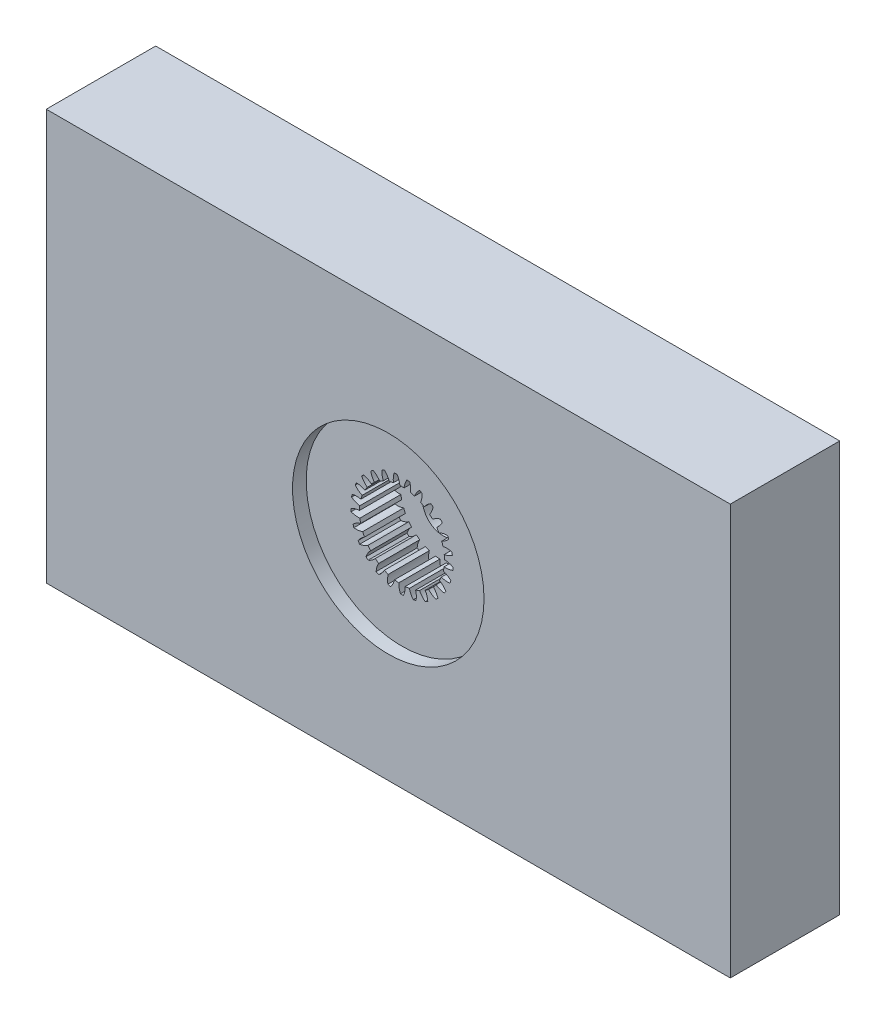
from build123d import *

# Parameters (mm, degrees)
SKETCH_1_W          = 50
SKETCH_1_H          = 30
EXTRUDE_1_DEPTH     = 8
SKETCH_2_R          = 3.731926356
SKETCH_2_R_2        = 1.5
EXTRUDE_2_DEPTH     = 4
SKETCH_3_R          = 3
CUT_EXTRUDE_1_DEPTH = 1
DRAFT_1_ANGLE       = 1
SKETCH_4_R          = 7
CUT_EXTRUDE_2_DEPTH = 1


with BuildPart() as part:
    # 草图1 → 凸台-拉伸1 (new body)
    with BuildSketch(Plane.XY):
        with Locations((-21.229575384, 10.124967507)):
            Rectangle(SKETCH_1_W, SKETCH_1_H)
        with BuildLine():
            ThreePointArc((-19.953798149, 13.632055583), (-20.162265024, 13.383796013), (-20.307173546, 13.093808474))
            ThreePointArc((-20.307173546, 13.093808474), (-20.456440087, 13.136130679), (-20.607632232, 13.170953153))
            ThreePointArc((-20.607632232, 13.170953153), (-20.594913976, 13.494881383), (-20.657994932, 13.812862586))
            ThreePointArc((-20.657994932, 13.812862586), (-20.761840986, 13.827466509), (-20.866056374, 13.839146858))
            ThreePointArc((-20.866056374, 13.839146858), (-21.006234235, 13.546843215), (-21.074473221, 13.229928884))
            ThreePointArc((-21.074473221, 13.229928884), (-21.229575384, 13.233800381), (-21.384677547, 13.229928884))
            ThreePointArc((-21.384677547, 13.229928884), (-21.452916533, 13.546843215), (-21.593094394, 13.839146858))
            ThreePointArc((-21.593094394, 13.839146858), (-21.697309781, 13.827466509), (-21.801155836, 13.812862586))
            ThreePointArc((-21.801155836, 13.812862586), (-21.864236792, 13.494881383), (-21.851518535, 13.170953153))
            ThreePointArc((-21.851518535, 13.170953153), (-22.00271068, 13.136130679), (-22.151977222, 13.093808474))
            ThreePointArc((-22.151977222, 13.093808474), (-22.296885744, 13.383796013), (-22.505352619, 13.632055583))
            ThreePointArc((-22.505352619, 13.632055583), (-22.603389104, 13.594824879), (-22.700340796, 13.554854302))
            ThreePointArc((-22.700340796, 13.554854302), (-22.682361238, 13.231175467), (-22.589484874, 12.92058694))
            ThreePointArc((-22.589484874, 12.92058694), (-22.727267043, 12.849258521), (-22.861318997, 12.771144867))
            ThreePointArc((-22.861318997, 12.771144867), (-23.073791919, 13.01598463), (-23.337449069, 13.204601065))
            ThreePointArc((-23.337449069, 13.204601065), (-23.423146658, 13.14415935), (-23.507112156, 13.081333617))
            ThreePointArc((-23.507112156, 13.081333617), (-23.409201806, 12.772295082), (-23.242003098, 12.494561677))
            ThreePointArc((-23.242003098, 12.494561677), (-23.35771793, 12.39120914), (-23.46813232, 12.282212204))
            ThreePointArc((-23.46813232, 12.282212204), (-23.734819188, 12.466520008), (-24.037100063, 12.583641845))
            ThreePointArc((-24.037100063, 12.583641845), (-24.105074062, 12.503786894), (-24.170777505, 12.422053576))
            ThreePointArc((-24.170777505, 12.422053576), (-23.99908843, 12.147073369), (-23.768073088, 11.919646098))
            ThreePointArc((-23.768073088, 11.919646098), (-23.854449795, 11.790763462), (-23.934288877, 11.657731923))
            ThreePointArc((-23.934288877, 11.657731923), (-24.238432774, 11.769927032), (-24.560343956, 11.808195073))
            ThreePointArc((-24.560343956, 11.808195073), (-24.606323308, 11.713944467), (-24.649636307, 11.61843917))
            ThreePointArc((-24.649636307, 11.61843917), (-24.414956364, 11.394795308), (-24.134639931, 11.231964262))
            ThreePointArc((-24.134639931, 11.231964262), (-24.186251147, 11.085649698), (-24.230498339, 10.936942417))
            ThreePointArc((-24.230498339, 10.936942417), (-24.552988785, 10.969975199), (-24.87430341, 10.926984924))
            ThreePointArc((-24.87430341, 10.926984924), (-24.895399064, 10.824260773), (-24.913600103, 10.720984446))
            ThreePointArc((-24.913600103, 10.720984446), (-24.630675096, 10.562729296), (-24.318670884, 10.474725749))
            ThreePointArc((-24.318670884, 10.474725749), (-24.332273686, 10.320172738), (-24.338148775, 10.165133541))
            ThreePointArc((-24.338148775, 10.165133541), (-24.658722509, 10.116928424), (-24.959251198, 9.99538107))
            ThreePointArc((-24.959251198, 9.99538107), (-24.954137635, 9.890637912), (-24.946083078, 9.786079786))
            ThreePointArc((-24.946083078, 9.786079786), (-24.632690224, 9.703157101), (-24.308602606, 9.695510639))
            ThreePointArc((-24.308602606, 9.695510639), (-24.28334228, 9.542430316), (-24.250476112, 9.390800885))
            ThreePointArc((-24.250476112, 9.390800885), (-24.548990308, 9.264386775), (-24.809849738, 9.071919609))
            ThreePointArc((-24.809849738, 9.071919609), (-24.778848263, 8.971738841), (-24.745044205, 8.872468688))
            ThreePointArc((-24.745044205, 8.872468688), (-24.420875131, 8.870088805), (-24.105067724, 8.943279884))
            ThreePointArc((-24.105067724, 8.943279884), (-24.04253147, 8.801290848), (-23.972989146, 8.662598618))
            ThreePointArc((-23.972989146, 8.662598618), (-24.230687059, 8.465918579), (-24.435486472, 8.21462502))
            ThreePointArc((-24.435486472, 8.21462502), (-24.380545022, 8.125301369), (-24.323115498, 8.037556697))
            ThreePointArc((-24.323115498, 8.037556697), (-24.008538939, 8.115869153), (-23.720855083, 8.265298908))
            ThreePointArc((-23.720855083, 8.265298908), (-23.624972283, 8.143322853), (-23.523123404, 8.026282367))
            ThreePointArc((-23.523123404, 8.026282367), (-23.723812926, 7.771694528), (-23.859684023, 7.477364275))
            ThreePointArc((-23.859684023, 7.477364275), (-23.78425477, 7.404510274), (-23.706808288, 7.333804404))
            ThreePointArc((-23.706808288, 7.333804404), (-23.421590245, 7.487888539), (-23.180106176, 7.704167749))
            ThreePointArc((-23.180106176, 7.704167749), (-23.056901499, 7.609868879), (-22.929145605, 7.521834222))
            ThreePointArc((-22.929145605, 7.521834222), (-23.060216676, 7.225335273), (-23.118622174, 6.906462179))
            ThreePointArc((-23.118622174, 6.906462179), (-23.027444617, 6.854655512), (-22.934847424, 6.805431154))
            ThreePointArc((-22.934847424, 6.805431154), (-22.696909197, 7.025605296), (-22.516798246, 7.295144343))
            ThreePointArc((-22.516798246, 7.295144343), (-22.374013095, 7.234447802), (-22.228377558, 7.180950514))
            ThreePointArc((-22.228377558, 7.180950514), (-22.2815945, 6.861170575), (-22.258864569, 6.537790609))
            ThreePointArc((-22.258864569, 6.537790609), (-22.157667728, 6.51028648), (-22.055738046, 6.485636582))
            ThreePointArc((-22.055738046, 6.485636582), (-21.880030168, 6.758066379), (-21.772609369, 7.063929133))
            ThreePointArc((-21.772609369, 7.063929133), (-21.619215461, 7.040648709), (-21.464851098, 7.025050221))
            ThreePointArc((-21.464851098, 7.025050221), (-21.436870094, 6.702082242), (-21.334432938, 6.394514556))
            ThreePointArc((-21.334432938, 6.394514556), (-21.229575384, 6.393041151), (-21.124717829, 6.394514556))
            ThreePointArc((-21.124717829, 6.394514556), (-21.022280673, 6.702082242), (-20.99429967, 7.025050221))
            ThreePointArc((-20.99429967, 7.025050221), (-20.839935307, 7.040648709), (-20.686541398, 7.063929133))
            ThreePointArc((-20.686541398, 7.063929133), (-20.579120599, 6.758066379), (-20.403412722, 6.485636582))
            ThreePointArc((-20.403412722, 6.485636582), (-20.30148304, 6.51028648), (-20.200286199, 6.537790609))
            ThreePointArc((-20.200286199, 6.537790609), (-20.177556268, 6.861170575), (-20.230773209, 7.180950514))
            ThreePointArc((-20.230773209, 7.180950514), (-20.085137673, 7.234447802), (-19.942352522, 7.295144343))
            ThreePointArc((-19.942352522, 7.295144343), (-19.762241571, 7.025605296), (-19.524303344, 6.805431154))
            ThreePointArc((-19.524303344, 6.805431154), (-19.43170615, 6.854655512), (-19.340528593, 6.906462179))
            ThreePointArc((-19.340528593, 6.906462179), (-19.398934092, 7.225335273), (-19.530005163, 7.521834222))
            ThreePointArc((-19.530005163, 7.521834222), (-19.402249269, 7.609868879), (-19.279044592, 7.704167749))
            ThreePointArc((-19.279044592, 7.704167749), (-19.037560522, 7.487888539), (-18.75234248, 7.333804404))
            ThreePointArc((-18.75234248, 7.333804404), (-18.674895997, 7.404510274), (-18.599466745, 7.477364275))
            ThreePointArc((-18.599466745, 7.477364275), (-18.735337841, 7.771694528), (-18.936027363, 8.026282367))
            ThreePointArc((-18.936027363, 8.026282367), (-18.834178485, 8.143322853), (-18.738295685, 8.265298908))
            ThreePointArc((-18.738295685, 8.265298908), (-18.450611829, 8.115869153), (-18.13603527, 8.037556697))
            ThreePointArc((-18.13603527, 8.037556697), (-18.078605746, 8.125301369), (-18.023664295, 8.21462502))
            ThreePointArc((-18.023664295, 8.21462502), (-18.228463709, 8.465918579), (-18.486161621, 8.662598618))
            ThreePointArc((-18.486161621, 8.662598618), (-18.416619298, 8.801290848), (-18.354083044, 8.943279884))
            ThreePointArc((-18.354083044, 8.943279884), (-18.038275637, 8.870088805), (-17.714106563, 8.872468688))
            ThreePointArc((-17.714106563, 8.872468688), (-17.680302505, 8.971738841), (-17.64930103, 9.071919609))
            ThreePointArc((-17.64930103, 9.071919609), (-17.91016046, 9.264386775), (-18.208674656, 9.390800885))
            ThreePointArc((-18.208674656, 9.390800885), (-18.175808487, 9.542430316), (-18.150548161, 9.695510639))
            ThreePointArc((-18.150548161, 9.695510639), (-17.826460544, 9.703157101), (-17.51306769, 9.786079786))
            ThreePointArc((-17.51306769, 9.786079786), (-17.505013132, 9.890637912), (-17.499899569, 9.99538107))
            ThreePointArc((-17.499899569, 9.99538107), (-17.800428259, 10.116928424), (-18.121001993, 10.165133541))
            ThreePointArc((-18.121001993, 10.165133541), (-18.126877082, 10.320172738), (-18.140479884, 10.474725749))
            ThreePointArc((-18.140479884, 10.474725749), (-17.828475672, 10.562729296), (-17.545550664, 10.720984446))
            ThreePointArc((-17.545550664, 10.720984446), (-17.563751704, 10.824260773), (-17.584847357, 10.926984924))
            ThreePointArc((-17.584847357, 10.926984924), (-17.906161983, 10.969975199), (-18.228652429, 10.936942417))
            ThreePointArc((-18.228652429, 10.936942417), (-18.272899621, 11.085649698), (-18.324510837, 11.231964262))
            ThreePointArc((-18.324510837, 11.231964262), (-18.044194404, 11.394795308), (-17.809514461, 11.61843917))
            ThreePointArc((-17.809514461, 11.61843917), (-17.852827459, 11.713944467), (-17.898806811, 11.808195073))
            ThreePointArc((-17.898806811, 11.808195073), (-18.220717994, 11.769927032), (-18.52486189, 11.657731923))
            ThreePointArc((-18.52486189, 11.657731923), (-18.604700973, 11.790763462), (-18.69107768, 11.919646098))
            ThreePointArc((-18.69107768, 11.919646098), (-18.460062337, 12.147073369), (-18.288373263, 12.422053576))
            ThreePointArc((-18.288373263, 12.422053576), (-18.354076706, 12.503786894), (-18.422050704, 12.583641845))
            ThreePointArc((-18.422050704, 12.583641845), (-18.72433158, 12.466520008), (-18.991018448, 12.282212204))
            ThreePointArc((-18.991018448, 12.282212204), (-19.101432837, 12.39120914), (-19.217147669, 12.494561677))
            ThreePointArc((-19.217147669, 12.494561677), (-19.049948961, 12.772295082), (-18.952038611, 13.081333617))
            ThreePointArc((-18.952038611, 13.081333617), (-19.036004109, 13.14415935), (-19.121701699, 13.204601065))
            ThreePointArc((-19.121701699, 13.204601065), (-19.385358848, 13.01598463), (-19.597831771, 12.771144867))
            ThreePointArc((-19.597831771, 12.771144867), (-19.731883725, 12.849258521), (-19.869665894, 12.92058694))
            ThreePointArc((-19.869665894, 12.92058694), (-19.776789529, 13.231175467), (-19.758809972, 13.554854302))
            ThreePointArc((-19.758809972, 13.554854302), (-19.855761663, 13.594824879), (-19.953798149, 13.632055583))
        make_face(mode=Mode.SUBTRACT)
    extrude(amount=EXTRUDE_1_DEPTH)

    # 草图2 → 凸台-拉伸2 (add)
    with BuildSketch(Plane(origin=(0, 0, 0), x_dir=(-1, 0, 0), z_dir=(0, 0, -1))):
        with Locations((21.229575384, 10.124967507)):
            Circle(SKETCH_2_R)
        with Locations((21.229575384, 10.124967507)):
            Circle(SKETCH_2_R_2, mode=Mode.SUBTRACT)
    extrude(amount=-EXTRUDE_2_DEPTH)

    # 草图3 → 切除-拉伸1 (cut)
    with BuildSketch(Plane(origin=(0, 0, 0), x_dir=(-1, 0, 0), z_dir=(0, 0, -1))):
        with Locations((21.229575384, 10.124967507)):
            Circle(SKETCH_3_R)
    extrude(amount=-CUT_EXTRUDE_1_DEPTH, mode=Mode.SUBTRACT)

    # 拔模1
    draft_1_faces = [part.faces().sort_by_distance(p)[0] for p in [
        (-18.229575384, 10.124967507, 0.5),
    ]]
    draft(draft_1_faces, Plane(origin=(-21.229575384, 10.124967507, 1), x_dir=(-1, 0, 0), z_dir=(0, 0, -1)), DRAFT_1_ANGLE)

    # 草图4 → 切除-拉伸2 (cut)
    with BuildSketch(Plane.XY.offset(8)):
        with Locations((-21.229575384, 10.124967507)):
            Circle(SKETCH_4_R)
    extrude(amount=-CUT_EXTRUDE_2_DEPTH, mode=Mode.SUBTRACT)


solid = part.part
